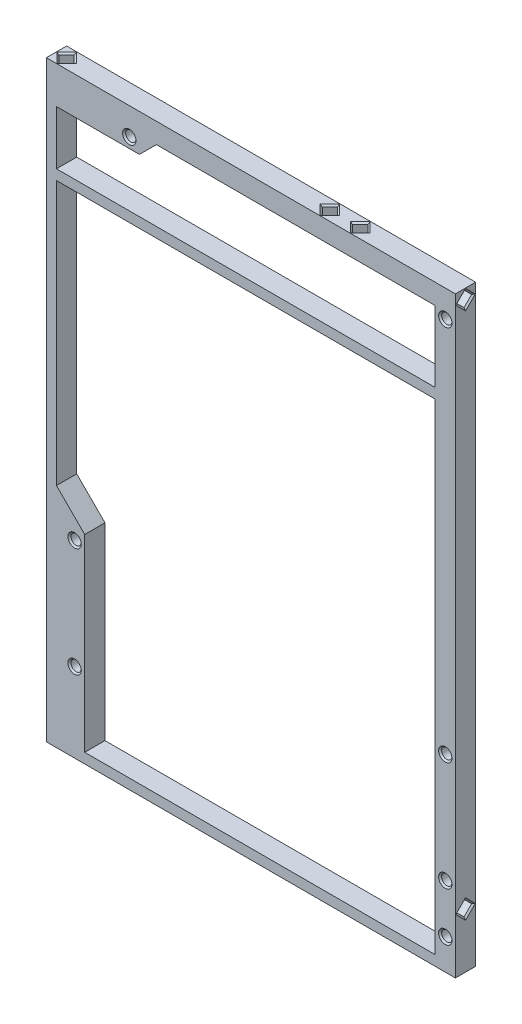
from build123d import *

# Parameters (mm, degrees)
BOSS_EXTRUDE1_START                    = -9.525
SKETCH1_W                              = 170.984333333
SKETCH1_H                              = 247.65
BOSS_EXTRUDE1_DEPTH                    = 8.466666667
F_18_0_1695_DIAMETER_HOLE1_D           = 4.3053
F_18_0_1695_DIAMETER_HOLE1_CSINK_D     = 5.5753
F_18_0_1695_DIAMETER_HOLE1_CSINK_ANGLE = 90
BOTTOM_PINS_DEPTH                      = 6.35
REAR_PINS_DEPTH                        = 6.35
FRONT_PINS_DEPTH                       = 6.35
CUT_EXTRUDE1_DEPTH                     = 6.35
PIN_CHAMFERS_SIZE                      = 0.635


with BuildPart() as part:
    # Sketch1 → Boss-Extrude1 (new body)
    with BuildSketch(Plane.XY.offset(BOSS_EXTRUDE1_START)):
        with Locations((-38.078833334, 3.0734)):
            Rectangle(SKETCH1_W, SKETCH1_H)
        Polygon((-107.526666667, -116.518266667), (-107.526666667, -37.676666709), (-119.337666709, -25.865666667), (-119.337666709, 84.565066667), (38.946666667, 84.565066667), (38.946666667, -116.518266667), align=None, mode=Mode.SUBTRACT)
        Polygon((-119.337666709, 111.336666667), (-84.666666667, 111.336666667), (-77.5716, 118.431733333), (38.946666667, 118.431733333), (38.946666667, 88.7984), (-119.337666709, 88.7984), align=None, mode=Mode.SUBTRACT)
    extrude(amount=-BOSS_EXTRUDE1_DEPTH)

    # #18 (0.1695) Diameter Hole1 (through all)
    with Locations(Plane.XY.offset(-9.525)):
        with Locations((-88.9, 115.57), (43.18, 115.57), (43.18, -41.91), (43.18, -87.63), (43.18, -107.95), (-111.76, -87.63), (-111.76, -41.91)):
            CounterSinkHole(F_18_0_1695_DIAMETER_HOLE1_D / 2, F_18_0_1695_DIAMETER_HOLE1_CSINK_D / 2, counter_sink_angle=F_18_0_1695_DIAMETER_HOLE1_CSINK_ANGLE)

    # Sketch2 → bottom pins (cut)
    with BuildSketch(Plane.XZ.offset(120.7516)):
        Polygon((-122.512666667, -13.758333333), (-119.337666667, -10.583333333), (-116.162666667, -13.758333333), (-119.337666667, -16.933333333), align=None)
        Polygon((40.005, -13.758333333), (43.18, -10.583333333), (46.355, -13.758333333), (43.18, -16.933333333), align=None)
    extrude(amount=-BOTTOM_PINS_DEPTH, mode=Mode.SUBTRACT)

    # Sketch3 → rear pins (cut)
    with BuildSketch(Plane.ZY.offset(123.571)):
        Polygon((-16.933333333, 115.57), (-13.758333333, 118.745), (-10.583333333, 115.57), (-13.758333333, 112.395), align=None)
    extrude(amount=-REAR_PINS_DEPTH, mode=Mode.SUBTRACT)

    # Sketch4 → front pins (cut)
    with BuildSketch(Plane(origin=(47.413333333, 0, 0), x_dir=(0, 0, -1), z_dir=(1, 0, 0))):
        Polygon((10.583333333, 122.665066667), (13.758333333, 125.840066667), (16.933333333, 122.665066667), (13.758333333, 119.490066667), align=None)
        Polygon((10.583333333, -97.8916), (13.758333333, -94.7166), (16.933333333, -97.8916), (13.758333333, -101.0666), align=None)
    extrude(amount=-FRONT_PINS_DEPTH, mode=Mode.SUBTRACT)

    # Sketch7 → Cut-Extrude1 (cut)
    with BuildSketch(Plane(origin=(0, 126.8984, 0), x_dir=(1, 0, 0), z_dir=(0, 1, 0))):
        Polygon((-6.095999915, 13.758333333), (-9.270999915, 10.583333333), (-12.445999915, 13.758333333), (-9.270999915, 16.933333333), align=None)
        Polygon((-116.162666667, 13.758333333), (-119.337666667, 10.583333333), (-122.512666667, 13.758333333), (-119.337666667, 16.933333333), align=None)
        Polygon((0.254000085, 13.758333333), (3.429000085, 16.933333333), (6.604000085, 13.758333333), (3.429000085, 10.583333333), align=None)
    extrude(amount=-CUT_EXTRUDE1_DEPTH, mode=Mode.SUBTRACT)

    # pin chamfers
    pin_chamfers_edges = [part.edges().sort_by_distance(p)[0] for p in [
        (-120.925166667, -114.4016, -15.345833333),
        (-120.925166667, -114.4016, -12.170833333),
        (-117.750166667, -114.4016, -12.170833333),
        (-117.750166667, -114.4016, -15.345833333),
        (-120.925166667, -120.7516, -15.345833333),
        (-117.750166667, -120.7516, -15.345833333),
        (-117.750166667, -120.7516, -12.170833333),
        (-120.925166667, -120.7516, -12.170833333),
        (41.5925, -114.4016, -15.345833333),
        (41.5925, -114.4016, -12.170833333),
        (44.7675, -114.4016, -12.170833333),
        (44.7675, -114.4016, -15.345833333),
        (41.5925, -120.7516, -15.345833333),
        (44.7675, -120.7516, -15.345833333),
        (44.7675, -120.7516, -12.170833333),
        (41.5925, -120.7516, -12.170833333),
        (-117.221, 113.9825, -15.345833333),
        (-117.221, 117.1575, -15.345833333),
        (-117.221, 117.1575, -12.170833333),
        (-117.221, 113.9825, -12.170833333),
        (-123.571, 113.9825, -15.345833333),
        (-123.571, 113.9825, -12.170833333),
        (-123.571, 117.1575, -12.170833333),
        (-123.571, 117.1575, -15.345833333),
        (41.063333333, 121.077566667, -12.170833333),
        (41.063333333, 124.252566667, -12.170833333),
        (41.063333333, 124.252566667, -15.345833333),
        (41.063333333, 121.077566667, -15.345833333),
        (47.413333333, 121.077566667, -12.170833333),
        (47.413333333, 121.077566667, -15.345833333),
        (47.413333333, 124.252566667, -15.345833333),
        (47.413333333, 124.252566667, -12.170833333),
        (41.063333333, -99.4791, -12.170833333),
        (41.063333333, -96.3041, -12.170833333),
        (41.063333333, -96.3041, -15.345833333),
        (41.063333333, -99.4791, -15.345833333),
        (47.413333333, -99.4791, -12.170833333),
        (47.413333333, -99.4791, -15.345833333),
        (47.413333333, -96.3041, -15.345833333),
        (47.413333333, -96.3041, -12.170833333),
        (1.841500085, 120.5484, -12.170833333),
        (1.841500085, 120.5484, -15.345833333),
        (5.016500085, 120.5484, -15.345833333),
        (5.016500085, 120.5484, -12.170833333),
        (1.841500085, 126.8984, -12.170833333),
        (5.016500085, 126.8984, -12.170833333),
        (5.016500085, 126.8984, -15.345833333),
        (1.841500085, 126.8984, -15.345833333),
        (-117.750166667, 120.5484, -15.345833333),
        (-117.750166667, 120.5484, -12.170833333),
        (-120.925166667, 120.5484, -12.170833333),
        (-120.925166667, 120.5484, -15.345833333),
        (-117.750166667, 126.8984, -15.345833333),
        (-120.925166667, 126.8984, -15.345833333),
        (-120.925166667, 126.8984, -12.170833333),
        (-117.750166667, 126.8984, -12.170833333),
        (-7.683499915, 120.5484, -15.345833333),
        (-7.683499915, 120.5484, -12.170833333),
        (-10.858499915, 120.5484, -12.170833333),
        (-10.858499915, 120.5484, -15.345833333),
        (-7.683499915, 126.8984, -15.345833333),
        (-10.858499915, 126.8984, -15.345833333),
        (-10.858499915, 126.8984, -12.170833333),
        (-7.683499915, 126.8984, -12.170833333),
    ]]
    chamfer(pin_chamfers_edges, length=PIN_CHAMFERS_SIZE)


solid = part.part
